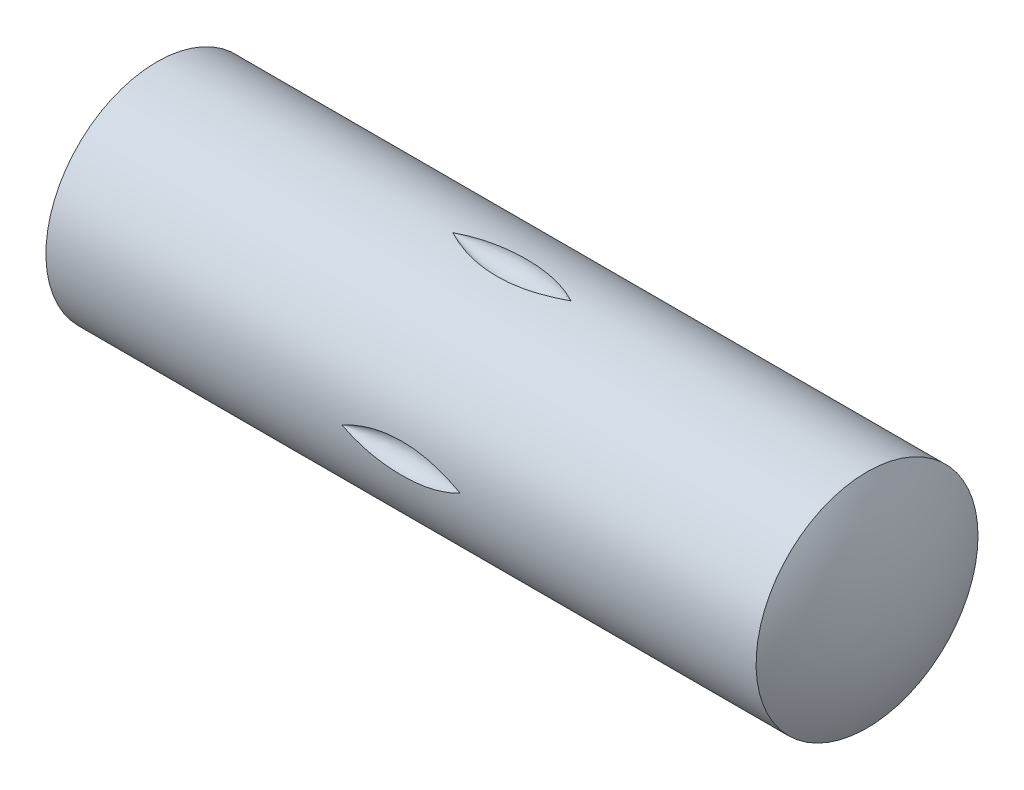
from build123d import *

# Parameters (mm, degrees)
R_P_TITION_CIRCULAIRE1_COUNT = 4


with BuildPart() as part:
    # Esquisse1 → Base-Révolution (revolve)
    with BuildSketch(Plane.XY):
        with BuildLine():
            Line((-8, 2.5), (8, 2.5))
            ThreePointArc((8, 2.5), (8.499595763, 1.294111664), (8.67, 0))
            Line((8.67, 0), (-8.67, 0))
            ThreePointArc((-8.67, 0), (-8.499595763, 1.294111664), (-8, 2.5))
        make_face()
    revolve(axis=Axis((0, 0, 0), (-1, 0, 0)))

    # Esquisse2 → Enlever de la matière-Révolution1 (revolve, cut)
    with BuildSketch(Plane(origin=(0, 2.5, 0), x_dir=(-1, 0, 0), z_dir=(0, 1, 0))):
        with BuildLine():
            Line((1.333333333, 0), (-1.333333333, 0))
            ThreePointArc((-1.333333333, 0), (-0.687386859, 0.249968429), (0, 0.335))
            ThreePointArc((0, 0.335), (0.687386859, 0.249968429), (1.333333333, 0))
        make_face()
    enlever_de_la_mati_re_r_volution1 = revolve(axis=Axis((0, 2.5, 0), (1, 0, 0)), mode=Mode.SUBTRACT)

    # Répétition circulaire1: Enlever de la matière-Révolution1 ×4 about axis
    r_p_tition_circulaire1_axis = Axis((50, 0, 0), (-1, 0, 0))
    for i in range(1, R_P_TITION_CIRCULAIRE1_COUNT):
        add(enlever_de_la_mati_re_r_volution1.rotate(r_p_tition_circulaire1_axis, i * 360 / R_P_TITION_CIRCULAIRE1_COUNT), mode=Mode.SUBTRACT)


solid = part.part
